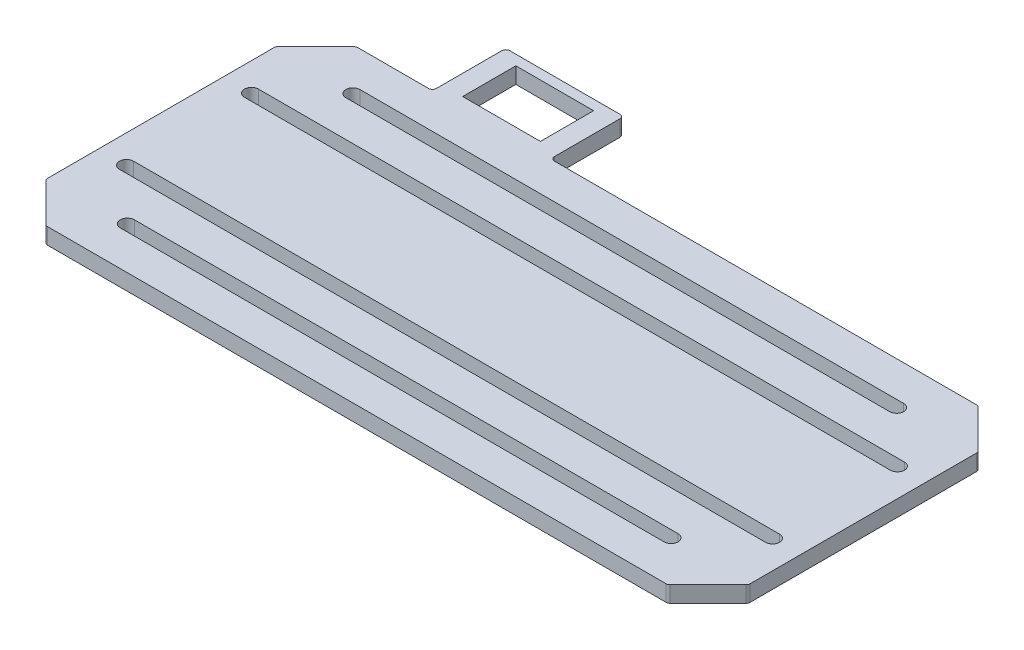
from build123d import *

# Parameters (mm, degrees)
SKETCH2_W           = 174.37
SKETCH2_H           = 77
BOSS_EXTRUDE1_DEPTH = 4
CUT_EXTRUDE1_DEPTH  = 4
SKETCH4_W           = 29.3
SKETCH4_H           = 18.2
SKETCH4_W_2         = 19.3
SKETCH4_H_2         = 13.2
BOSS_EXTRUDE2_DEPTH = 4
CHAMFER1_SIZE       = 10
FILLET1_R           = 1
CUT_EXTRUDE2_DEPTH  = 10


with BuildPart() as part:
    # Sketch2 → Boss-Extrude1 (new body)
    with BuildSketch(Plane(origin=(0, 0, 0), x_dir=(1, 0, 0), z_dir=(0, 1, 0))):
        Rectangle(SKETCH2_W, SKETCH2_H)
    extrude(amount=BOSS_EXTRUDE1_DEPTH)

    # Sketch3 → Cut-Extrude1 (cut)
    with BuildSketch(Plane(origin=(0, 4, 0), x_dir=(1, 0, 0), z_dir=(0, 1, 0))):
        with BuildLine():
            Line((-67.5, 29.75), (67.5, 29.75))
            ThreePointArc((67.5, 29.75), (69.25, 28), (67.5, 26.25))
            Line((67.5, 26.25), (-67.5, 26.25))
            ThreePointArc((-67.5, 26.25), (-69.25, 28), (-67.5, 29.75))
        make_face()
        with BuildLine():
            Line((-67.5, -29.75), (67.5, -29.75))
            ThreePointArc((67.5, -29.75), (69.25, -28), (67.5, -26.25))
            Line((67.5, -26.25), (-67.5, -26.25))
            ThreePointArc((-67.5, -26.25), (-69.25, -28), (-67.5, -29.75))
        make_face()
    extrude(amount=-CUT_EXTRUDE1_DEPTH, mode=Mode.SUBTRACT)

    # Sketch4 → Boss-Extrude2 (add)
    with BuildSketch(Plane.XZ):
        with Locations((-43.5925, -47.6)):
            Rectangle(SKETCH4_W, SKETCH4_H)
        with Locations((-43.5925, -47.6)):
            Rectangle(SKETCH4_W_2, SKETCH4_H_2, mode=Mode.SUBTRACT)
    extrude(amount=-BOSS_EXTRUDE2_DEPTH)

    # Chamfer1
    chamfer1_edges = [part.edges().sort_by_distance(p)[0] for p in [
        (-87.185, 2, -38.5),
        (87.185, 2, -38.5),
        (87.185, 2, 38.5),
        (-87.185, 2, 38.5),
    ]]
    chamfer(chamfer1_edges, length=CHAMFER1_SIZE)

    # Fillet1
    fillet1_edges = [part.edges().sort_by_distance(p)[0] for p in [
        (-58.2425, 2, -56.7),
        (-58.2425, 2, -38.5),
        (-28.9425, 2, -38.5),
        (-28.9425, 2, -56.7),
        (-87.185, 2, 28.5),
        (-87.185, 2, -28.5),
        (-77.185, 2, -38.5),
        (77.185, 2, -38.5),
        (87.185, 2, 28.5),
        (87.185, 2, -28.5),
        (-77.185, 2, 38.5),
        (77.185, 2, 38.5),
    ]]
    fillet(fillet1_edges, radius=FILLET1_R)

    # Sketch5 → Cut-Extrude2 (cut)
    with BuildSketch(Plane(origin=(0, 4, 0), x_dir=(1, 0, 0), z_dir=(0, 1, 0))):
        with BuildLine():
            Line((-80.185, 13.75), (80.185, 13.75))
            ThreePointArc((80.185, 13.75), (81.935, 15.5), (80.185, 17.25))
            Line((80.185, 17.25), (-80.185, 17.25))
            ThreePointArc((-80.185, 17.25), (-81.935, 15.5), (-80.185, 13.75))
        make_face()
        with BuildLine():
            Line((80.185, -17.25), (-80.185, -17.25))
            ThreePointArc((-80.185, -17.25), (-81.935, -15.5), (-80.185, -13.75))
            Line((-80.185, -13.75), (80.185, -13.75))
            ThreePointArc((80.185, -13.75), (81.935, -15.5), (80.185, -17.25))
        make_face()
    extrude(amount=-CUT_EXTRUDE2_DEPTH, mode=Mode.SUBTRACT)


solid = part.part
